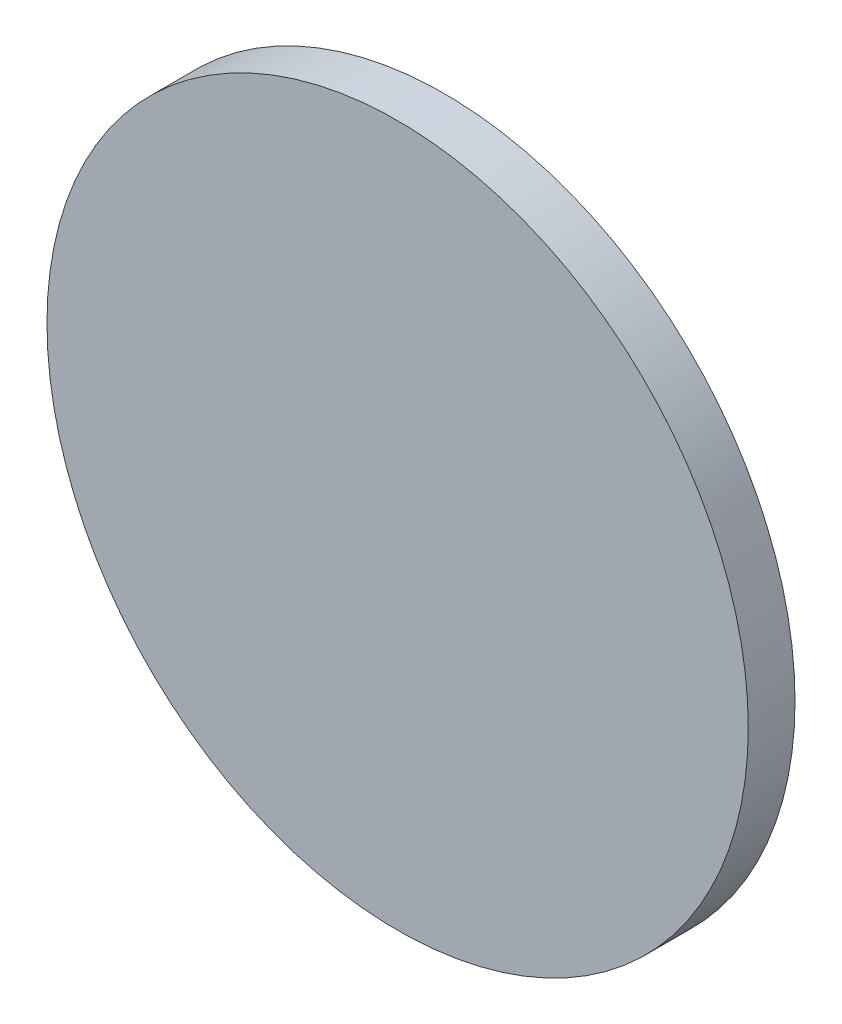
from build123d import *

# Parameters (mm, degrees)
SKETCH_1_R      = 60
EXTRUDE_1_DEPTH = 8


with BuildPart() as part:
    # 草图1 → 凸台-拉伸1 (new body)
    with BuildSketch(Plane.XY):
        Circle(SKETCH_1_R)
    extrude(amount=EXTRUDE_1_DEPTH)


solid = part.part
